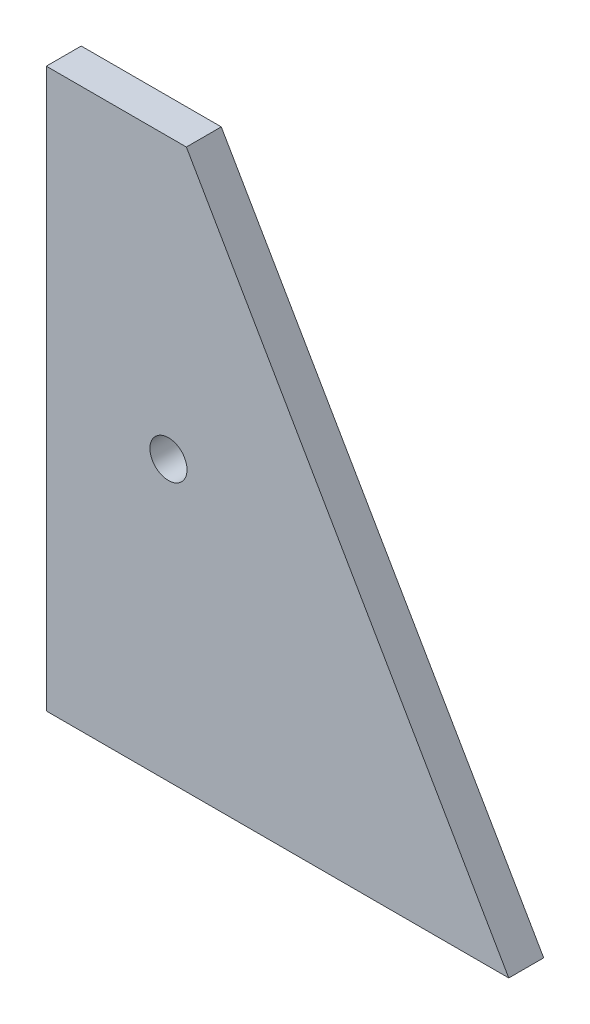
from build123d import *

# Parameters (mm, degrees)
BOSS_EXTRUDE1_DEPTH     = 6.35
F_1_2_CLEARANCE_HOLE1_D = 13.49248


with BuildPart() as part:
    # Sketch1 → Boss-Extrude1 (new, symmetric)
    with BuildSketch(Plane.XY):
        Polygon((0, 0), (0, 203.2), (50.957425301, 203.2), (168.275, 0), align=None)
    extrude(amount=BOSS_EXTRUDE1_DEPTH, both=True)

    # 1/2 Clearance Hole1 (through all)
    with Locations(Plane.XY.offset(6.35)):
        with Locations((44.45, 101.6)):
            Hole(F_1_2_CLEARANCE_HOLE1_D / 2)


solid = part.part
